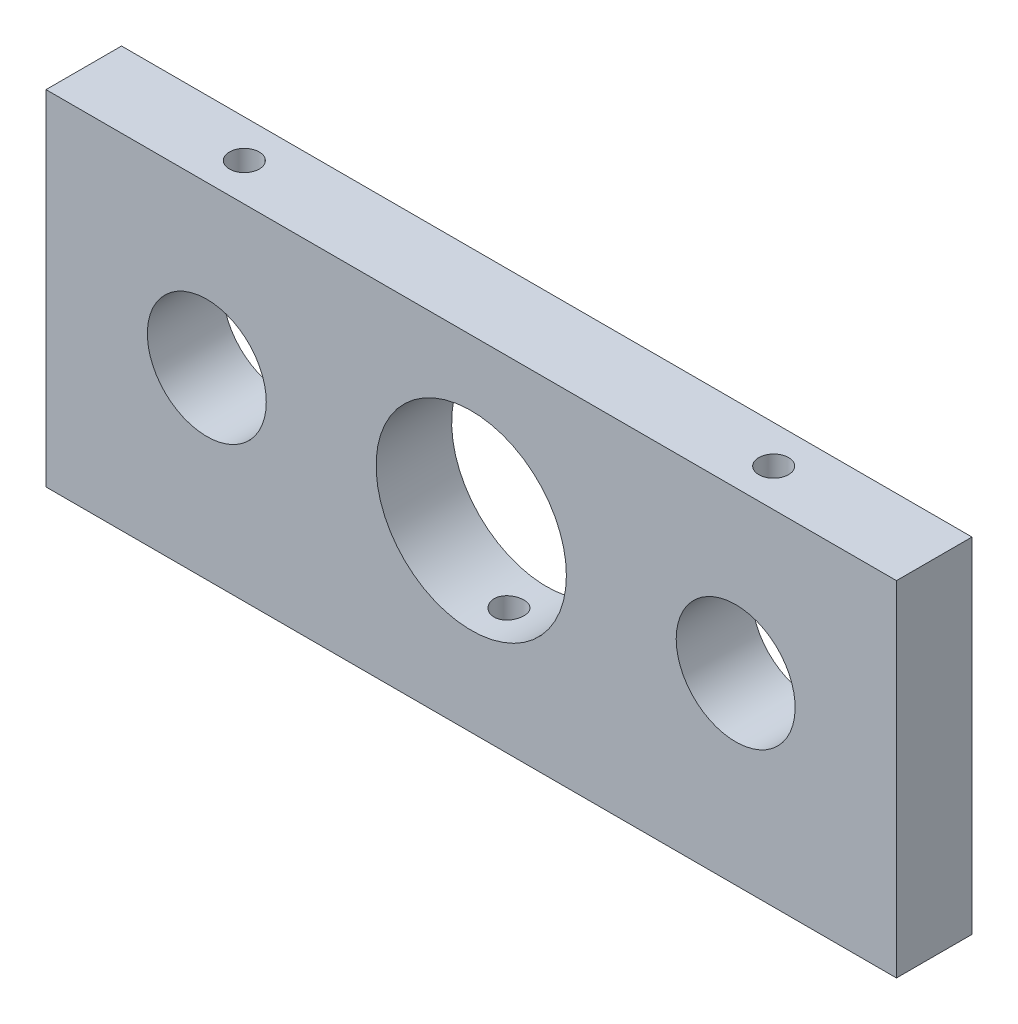
from build123d import *

# Parameters (mm, degrees)
ESBO_O1_W                = 143.01
ESBO_O1_H                = 54
RESSALTO_EXTRUS_O1_DEPTH = 10
ESBO_O14_W               = 2.7
ESBO_O14_H               = 57.87
RESSALTO_EXTRUS_O3_DEPTH = 143.01
ESBO_O2_R                = 16
CIRCULO_ROLAMENTO_DEPTH  = 19
ESBO_O7_R                = 10
CORTE_EXTRUS_O3_DEPTH    = 19
ESBO_O8_W                = 143.01
ESBO_O8_H                = 3.87
RESSALTO_EXTRUS_O2_DEPTH = 10
ESBO_O12_R               = 2.5
CORTE_EXTRUS_O6_DEPTH    = 17
CORTE_EXTRUS_O7_REACH    = 94.531
ESBO_O15_R               = 2.5


with BuildPart() as part:
    # Esboço1 → Ressalto-extrusão1 (new body)
    with BuildSketch(Plane.XY):
        Rectangle(ESBO_O1_W, ESBO_O1_H)
    extrude(amount=RESSALTO_EXTRUS_O1_DEPTH)

    # Esboço14 → Ressalto-extrusão3 (add)
    with BuildSketch(Plane.ZY.offset(71.505)):
        with Locations((-1.35, -1.935)):
            Rectangle(ESBO_O14_W, ESBO_O14_H)
    extrude(amount=-RESSALTO_EXTRUS_O3_DEPTH)

    # Esboço2 → Circulo rolamento (cut)
    with BuildSketch(Plane.XY.offset(10)):
        Circle(ESBO_O2_R)
    extrude(amount=-CIRCULO_ROLAMENTO_DEPTH, mode=Mode.SUBTRACT)

    # Esboço7 → Corte-extrusão3 (cut)
    with BuildSketch(Plane.XY.offset(10)):
        with Locations((-44.465, 0)):
            Circle(ESBO_O7_R)
        with Locations(Location((44.465, 0, 0), (0, 0, 90))):
            Circle(ESBO_O7_R)
    extrude(amount=-CORTE_EXTRUS_O3_DEPTH, mode=Mode.SUBTRACT)

    # Esboço8 → Ressalto-extrusão2 (add)
    with BuildSketch(Plane.XY.offset(10)):
        with Locations((0, -28.935)):
            Rectangle(ESBO_O8_W, ESBO_O8_H)
    extrude(amount=-RESSALTO_EXTRUS_O2_DEPTH)

    # Esboço12 → Corte-extrusão6 (cut)
    with BuildSketch(Plane.XZ.offset(30.87)):
        with Locations(Location((-61.505, 3.65, 0), (0, 0, 270))):
            Circle(ESBO_O12_R)
        with Locations(Location((61.505, 3.65, 0), (0, 0, 90))):
            Circle(ESBO_O12_R)
        with Locations(Location((0, 3.65, 0), (0, 0, 270))):
            Circle(ESBO_O12_R)
        with Locations(Location((-33.505, 3.65, 0), (0, 0, 270))):
            Circle(ESBO_O12_R)
        with Locations(Location((33.505, 3.65, 0), (0, 0, 90))):
            Circle(ESBO_O12_R)
    extrude(amount=-CORTE_EXTRUS_O6_DEPTH, mode=Mode.SUBTRACT)

    # Esboço15 → Corte-extrusão7 (cut, up to next)
    with BuildSketch(Plane(origin=(0, 27, 0), x_dir=(1, 0, 0), z_dir=(0, 1, 0)), mode=Mode.PRIVATE) as corte_extrus_o7_sk1:
        with Locations(Location((-44.505, -3.65, 0), (0, 0, 270))):
            Circle(ESBO_O15_R)
    corte_extrus_o7_tool1 = extrude(corte_extrus_o7_sk1.sketch, amount=-CORTE_EXTRUS_O7_REACH, mode=Mode.PRIVATE) & part.part
    # Esboço15 → Corte-extrusão7 (cut, up to next)
    with BuildSketch(Plane(origin=(0, 27, 0), x_dir=(1, 0, 0), z_dir=(0, 1, 0)), mode=Mode.PRIVATE) as corte_extrus_o7_sk2:
        with Locations(Location((44.505, -3.65, 0), (0, 0, 270))):
            Circle(ESBO_O15_R)
    corte_extrus_o7_tool2 = extrude(corte_extrus_o7_sk2.sketch, amount=-CORTE_EXTRUS_O7_REACH, mode=Mode.PRIVATE) & part.part
    add(corte_extrus_o7_tool1.solids().sort_by_distance((-44.505, 27, 3.65))[0], mode=Mode.SUBTRACT)
    add(corte_extrus_o7_tool2.solids().sort_by_distance((44.505, 27, 3.65))[0], mode=Mode.SUBTRACT)


solid = part.part
